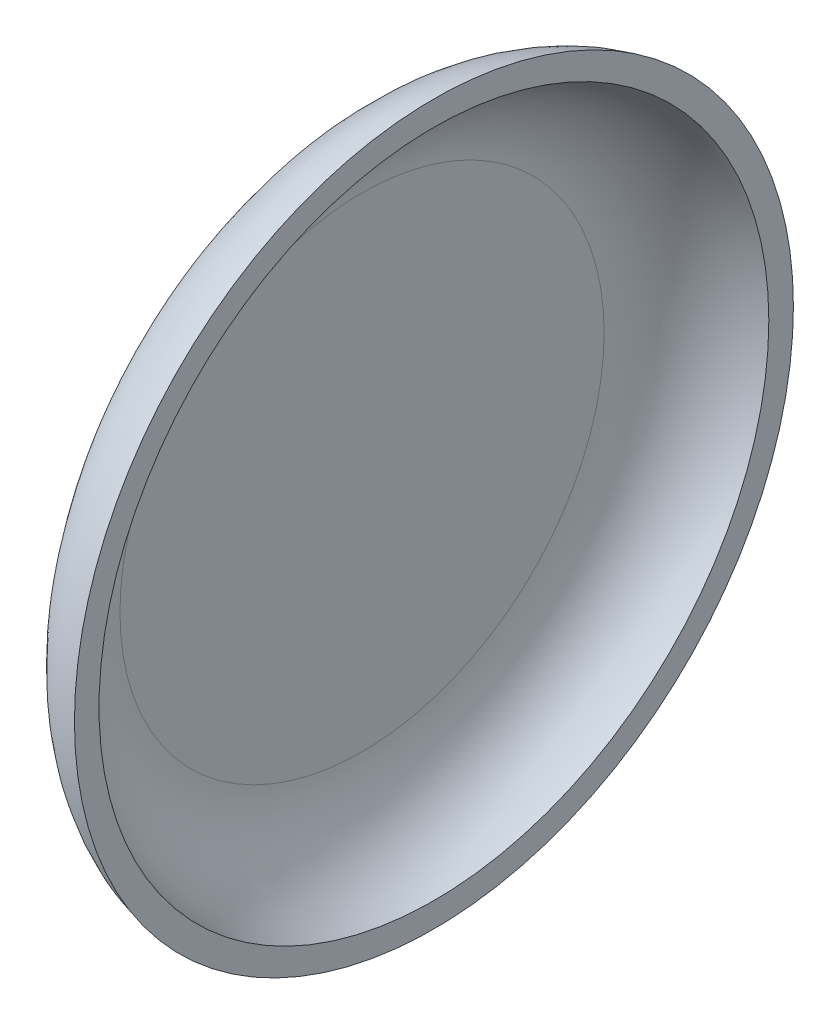
from build123d import *


with BuildPart() as part:
    # Sketch1 → Revolve1 (revolve)
    with BuildSketch(Plane.XY, mode=Mode.PRIVATE) as revolve1_sk:
        with BuildLine():
            Line((-4, 0), (-4, 10.101020514))
            ThreePointArc((-4, 10.101020514), (-2.872983346, 13.263298175), (0, 15))
            Line((0, 15), (0, 13.974003861))
            ThreePointArc((0, 13.974003861), (-2.16227766, 12.550510257), (-3, 10.101020514))
            Line((-3, 10.101020514), (-3, 0))
            Line((-3, 0), (-4, 0))
        make_face()
    revolve(revolve1_sk.sketch.rotate(Axis((0, 0, 0), (-1, 0, 0)), 90), axis=Axis((0, 0, 0), (-1, 0, 0)))


solid = part.part
